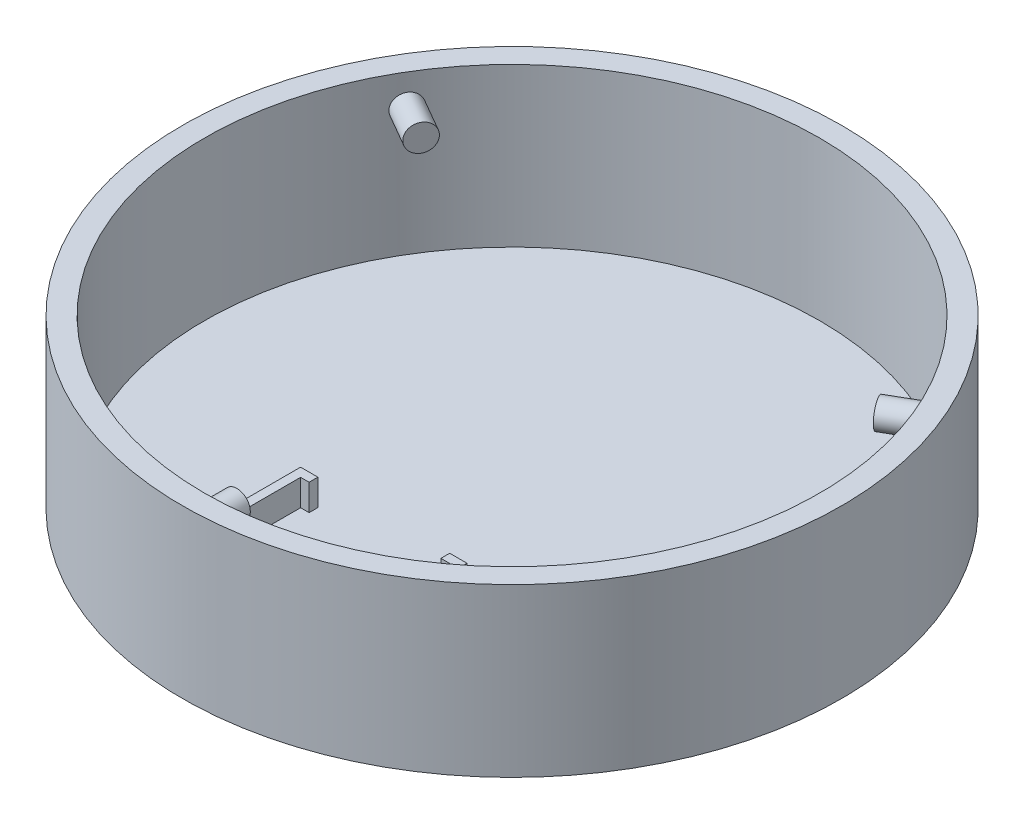
from build123d import *

# Parameters (mm, degrees)
SKETCH1_R           = 95.25
BOSS_EXTRUDE1_DEPTH = 48.26
SKETCH2_R           = 88.9
CUT_EXTRUDE1_DEPTH  = 45.72
SKETCH3_R           = 3.875
BOSS_EXTRUDE4_DEPTH = 11
CIRPATTERN1_COUNT   = 3
SKETCH8_W           = 48.096
SKETCH8_H           = 48.096
SKETCH8_W_2         = 43.016
SKETCH8_H_2         = 43.016
BOSS_EXTRUDE5_DEPTH = 7.62
SKETCH10_W          = 38.096
SKETCH10_H          = 7.62
CUT_EXTRUDE2_DEPTH  = 2.54


with BuildPart() as part:
    # Sketch1 → Boss-Extrude1 (new body)
    with BuildSketch(Plane(origin=(0, 0, 0), x_dir=(1, 0, 0), z_dir=(0, 1, 0))):
        with Locations(Location((0, 0, 0), (0, 0, 90))):
            Circle(SKETCH1_R)
    extrude(amount=BOSS_EXTRUDE1_DEPTH)

    # Sketch2 → Cut-Extrude1 (cut)
    with BuildSketch(Plane(origin=(0, 48.26, 0), x_dir=(1, 0, 0), z_dir=(0, 1, 0))):
        with Locations(Location((0, 0, 0), (0, 0, 270))):
            Circle(SKETCH2_R)
    extrude(amount=-CUT_EXTRUDE1_DEPTH, mode=Mode.SUBTRACT)

    # Sketch3 → Boss-Extrude4 (add)
    with BuildSketch(Plane(origin=(0, 0, 88.9), x_dir=(-1, 0, 0), z_dir=(0, 0, -1))):
        with Locations((1.626800498, 39.26)):
            Circle(SKETCH3_R)
    boss_extrude4 = extrude(amount=BOSS_EXTRUDE4_DEPTH)

    # CirPattern1: Boss-Extrude4 ×3 about axis
    cirpattern1_axis = Axis((0, 0, 0), (0, 1, 0))
    for i in range(1, CIRPATTERN1_COUNT):
        add(boss_extrude4.rotate(cirpattern1_axis, i * 360 / CIRPATTERN1_COUNT))

    # Sketch8 → Boss-Extrude5 (add)
    with BuildSketch(Plane(origin=(0, 2.54, 0), x_dir=(1, 0, 0), z_dir=(0, 1, 0))):
        with Locations((-6.666911053, -54.455125388)):
            Rectangle(SKETCH8_W, SKETCH8_H)
        with Locations((-6.666911053, -54.455125388)):
            Rectangle(SKETCH8_W_2, SKETCH8_H_2, mode=Mode.SUBTRACT)
    extrude(amount=BOSS_EXTRUDE5_DEPTH)

    # Sketch10 → Cut-Extrude2 (cut)
    with BuildSketch(Plane(origin=(0, 0, 30.407125388), x_dir=(-1, 0, 0), z_dir=(0, 0, -1))):
        with Locations((6.666911053, 6.35)):
            Rectangle(SKETCH10_W, SKETCH10_H)
    extrude(amount=-CUT_EXTRUDE2_DEPTH, mode=Mode.SUBTRACT)


solid = part.part
